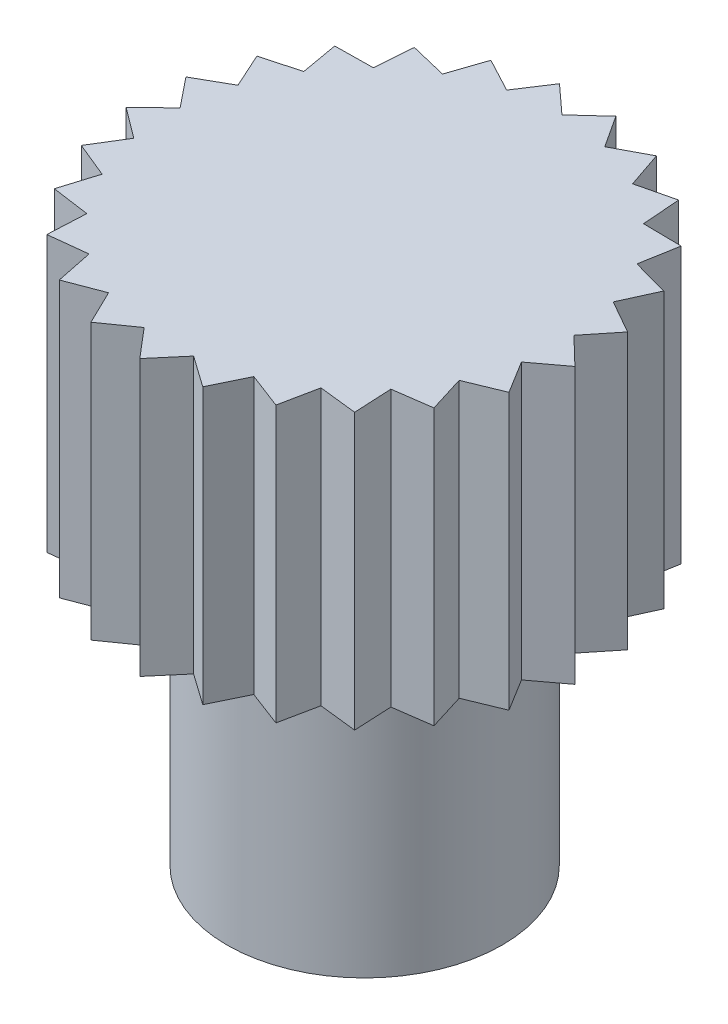
from build123d import *

# Parameters (mm, degrees)
SKETCH1_R           = 1.5
BOSS_EXTRUDE1_DEPTH = 3.01
BOSS_EXTRUDE2_DEPTH = 3


with BuildPart() as part:
    # Sketch1 → Boss-Extrude1 (new body)
    with BuildSketch(Plane(origin=(0, 0, 0), x_dir=(1, 0, 0), z_dir=(0, 1, 0))):
        with Locations(Location((0, 0, 0), (0, 0, 270))):
            Circle(SKETCH1_R)
    extrude(amount=BOSS_EXTRUDE1_DEPTH)

    # Sketch2 → Boss-Extrude2 (add)
    with BuildSketch(Plane(origin=(0, 3.01, 0), x_dir=(1, 0, 0), z_dir=(0, 1, 0))):
        Polygon((0.307066422, 2.430681018), (0.534683257, 2.082453796), (0.901905154, 2.27795239), (1.035770399, 1.884059362), (1.440073868, 1.982091636), (1.471776278, 1.567282549), (1.887757445, 1.561688775), (1.81530504, 1.152027609), (2.216826279, 1.043159264), (2.04477151, 0.664386538), (2.406603764, 0.459084221), (2.145757466, 0.134999617), (2.445165485, -0.153836773), (2.111917589, -0.402869826), (2.330088465, -0.757091636), (1.945378163, -0.915425477), (2.068603417, -1.312775648), (1.656603472, -1.370461578), (1.67714041, -1.785973137), (1.263738292, -1.739386538), (1.180296502, -2.146951366), (0.791467788, -1.999019445), (0.609290224, -2.373028745), (0.269466452, -2.133046608), (0, -2.45), (-0.269466452, -2.133046608), (-0.609290224, -2.373028745), (-0.791467788, -1.999019445), (-1.180296502, -2.146951366), (-1.263738292, -1.739386538), (-1.67714041, -1.785973137), (-1.656603472, -1.370461578), (-2.068603417, -1.312775648), (-1.945378163, -0.915425477), (-2.330088465, -0.757091636), (-2.111917589, -0.402869826), (-2.445165485, -0.153836773), (-2.145757466, 0.134999617), (-2.406603764, 0.459084221), (-2.04477151, 0.664386538), (-2.216826279, 1.043159264), (-1.81530504, 1.152027609), (-1.887757445, 1.561688775), (-1.471776278, 1.567282549), (-1.440073868, 1.982091636), (-1.035770399, 1.884059362), (-0.901905154, 2.27795239), (-0.534683257, 2.082453796), (-0.307066422, 2.430681018), (0, 2.15), align=None)
    extrude(amount=BOSS_EXTRUDE2_DEPTH)


solid = part.part
